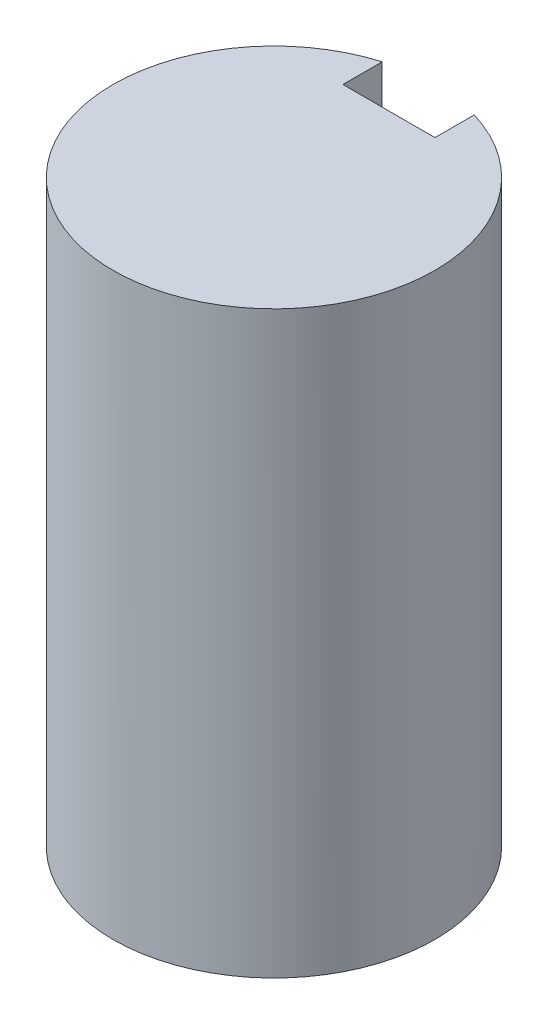
from build123d import *

# Parameters (mm, degrees)
SKETCH1_R           = 17.5
BOSS_EXTRUDE1_DEPTH = 63
CUT_EXTRUDE1_START  = -35
CUT_EXTRUDE1_DEPTH  = 35


with BuildPart() as part:
    # Sketch1 → Boss-Extrude1 (new body)
    with BuildSketch(Plane(origin=(0, 0, 0), x_dir=(1, 0, 0), z_dir=(0, 1, 0))):
        with Locations(Location((0, 0, 0), (0, 0, 270))):
            Circle(SKETCH1_R)
    extrude(amount=BOSS_EXTRUDE1_DEPTH)

    # Sketch2 → Cut-Extrude1 (cut)
    with BuildSketch(Plane(origin=(0, 63, 0), x_dir=(1, 0, 0), z_dir=(0, 1, 0)).offset(CUT_EXTRUDE1_START)):
        with BuildLine():
            Line((-5, 12.5), (5, 12.5))
            Line((5, 12.5), (5, 16.770509831))
            ThreePointArc((5, 16.770509831), (0, 17.5), (-5, 16.770509831))
            Line((-5, 16.770509831), (-5, 12.5))
        make_face()
    extrude(amount=CUT_EXTRUDE1_DEPTH, mode=Mode.SUBTRACT)


solid = part.part
